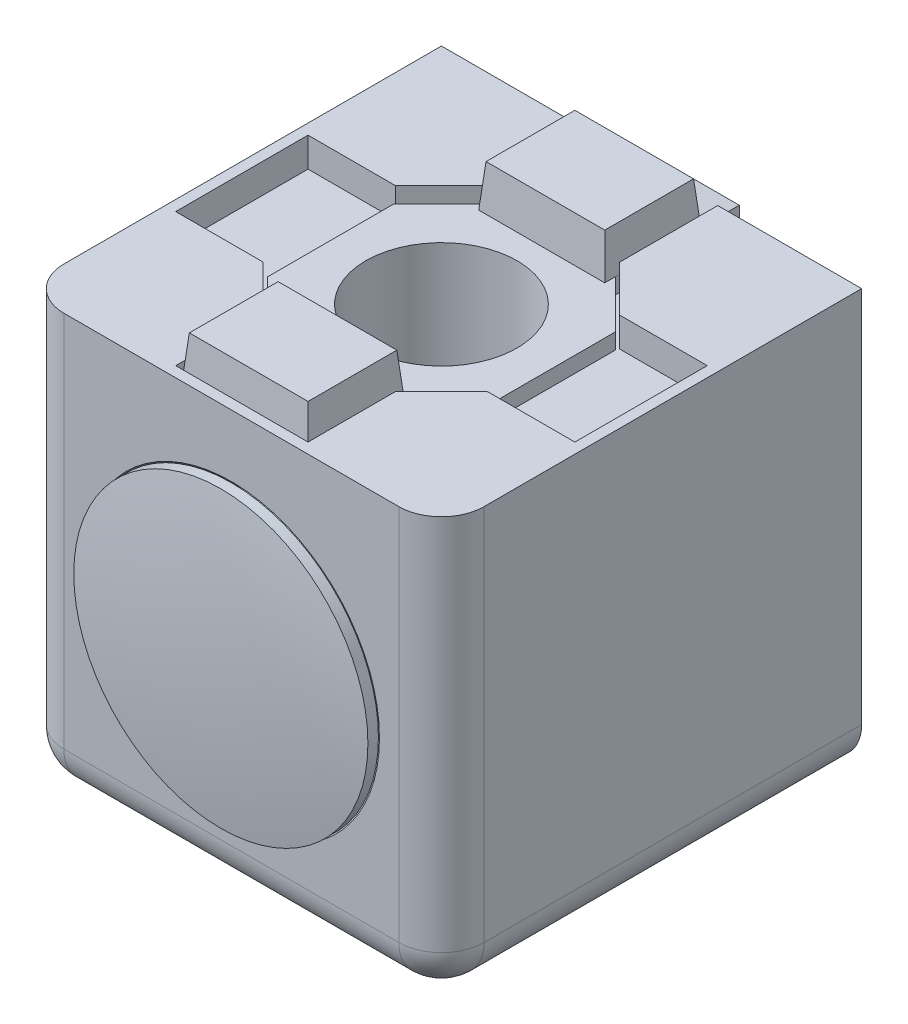
from build123d import *

# Parameters (mm, degrees)
SKETCH1_W                   = 20
SKETCH1_H                   = 20
EXTRUDE1_DEPTH              = 10
SKETCH2_R                   = 6
CUT_EXTRUDE1_DEPTH          = 25.494897428
EXTRUDE2_START              = -6
SKETCH4_R                   = 6
SKETCH4_R_2                 = 3.6
EXTRUDE2_DEPTH              = 6
CUT_EXTRUDE5_DEPTH          = 1.4
SKETCH13_R                  = 3.6
EXTRUDE3_DEPTH              = 0.75
SKETCH14_W                  = 6
SKETCH14_H                  = 4.57685066
EXTRUDE4_DEPTH              = 2
EXTRUDE4_DRAFT              = 5
EXTRUDE4_PROFILE_2_DEPTH    = 2
EXTRUDE4_PROFILE_2_DRAFT    = 5
FILLET2_R                   = 2.032
CIRPATTERN1_COUNT           = 2
CIRPATTERN1_ANGLE           = 90
CIRPATTERN1_COPY_1_SKETCH_W = 6
CIRPATTERN1_COPY_1_SKETCH_H = 4.57685066
CIRPATTERN1_COPY_1_DEPTH    = 2
CIRPATTERN1_COPY_1_DRAFT    = 5
CIRPATTERN1_COPY_2_SKETCH_W = 6
CIRPATTERN1_COPY_2_SKETCH_H = 4.57685066
CIRPATTERN1_COPY_2_DEPTH    = 2
CIRPATTERN1_COPY_2_DRAFT    = 5
CIRPATTERN1_COPY_3_SKETCH_W = 6
CIRPATTERN1_COPY_3_SKETCH_H = 4.57685066
CIRPATTERN1_COPY_3_DEPTH    = 2
CIRPATTERN1_COPY_3_DRAFT    = 5
SKETCH12_W                  = 6.3
SKETCH12_H                  = 0.5
CUT_EXTRUDE6_DEPTH          = 26.476901303


with BuildPart() as part:
    # Sketch1 → Extrude1 (new, symmetric)
    with BuildSketch(Plane.XY):
        Rectangle(SKETCH1_W, SKETCH1_H)
    extrude(amount=EXTRUDE1_DEPTH, both=True)

    # Sketch2 → Cut-Extrude1 (cut, through all)
    with BuildSketch(Plane.XY.offset(10)):
        Circle(SKETCH2_R)
    cut_extrude1 = extrude(amount=-CUT_EXTRUDE1_DEPTH, mode=Mode.SUBTRACT)

    # Cut-Extrude2 cone 1 section (through the dimple's axis) → Cut-Extrude2 (revolve, cut)
    with BuildSketch(Plane(origin=(0, 0, 10), x_dir=(0, -1, 0), z_dir=(1, 0, 0))):
        Polygon((0, 0), (7.05, 0), (0, 7.05), align=None)
    cut_extrude2 = revolve(axis=Axis((0, 0, 10), (0, 0, -1)), mode=Mode.SUBTRACT)

    # Sketch4 → Extrude2 (add)
    with BuildSketch(Plane(origin=(0, 0, -10), x_dir=(-1, 0, 0), z_dir=(0, 0, -1)).offset(EXTRUDE2_START)):
        with Locations(Location((0, 0, 0), (0, 0, 180))):
            Circle(SKETCH4_R)
        Circle(SKETCH4_R_2, mode=Mode.SUBTRACT)
    extrude2 = extrude(amount=EXTRUDE2_DEPTH)

    # Sketch10 → Cut-Extrude5 (cut)
    with BuildSketch(Plane(origin=(0, 0, -10), x_dir=(-1, 0, 0), z_dir=(0, 0, -1))):
        Polygon((-5.335281374, 3.15), (-3.15, 5.335281374), (-3.15, 9.5), (3.15, 9.5), (3.15, 5.335281374), (5.335281374, 3.15), (9.5, 3.15), (9.5, -3.15), (5.335281374, -3.15), (3.15, -5.335281374), (3.15, -9.5), (-3.15, -9.5), (-3.15, -5.335281374), (-5.335281374, -3.15), (-9.5, -3.15), (-9.5, 3.15), align=None)
    cut_extrude5 = extrude(amount=-CUT_EXTRUDE5_DEPTH, mode=Mode.SUBTRACT)

    # Sketch13 → Extrude3 (add)
    with BuildSketch(Plane(origin=(0, 0, -8.6), x_dir=(-1, 0, 0), z_dir=(0, 0, -1))):
        Polygon((5.27314934, 3), (5.27314934, -3), (3, -5.27314934), (3, -9.35), (-3, -9.35), (-3, -5.27314934), (-5.27314934, -3), (-5.27314934, 3), (-3, 5.27314934), (-3, 9.35), (3, 9.35), (3, 5.27314934), align=None)
        Circle(SKETCH13_R, mode=Mode.SUBTRACT)
    extrude3 = extrude(amount=EXTRUDE3_DEPTH)


with BuildPart() as extrude4_tool:
    # Sketch14 → Extrude4 (with draft: the straight prism first)
    with BuildSketch(Plane(origin=(0, 0, -9.35), x_dir=(-1, 0, 0), z_dir=(0, 0, -1))):
        with Locations((0, 7.06157467)):
            Rectangle(SKETCH14_W, SKETCH14_H)
    extrude(amount=EXTRUDE4_DEPTH)
    # Extrude4: the draft: its side faces are tilted about the plane it starts from
    extrude4_sides = [extrude4_tool.faces().sort_by_distance(p)[0] for p in [
        (3, 7.06157467, -10.35),
        (0, 4.77314934, -10.35),
        (-3, 7.06157467, -10.35),
        (0, 9.35, -10.35),
    ]]
    draft(extrude4_sides, Plane(origin=(0, 0, -9.35), x_dir=(-1, 0, 0), z_dir=(0, 0, -1)), EXTRUDE4_DRAFT)


with BuildPart() as part_1:
    add(part.part)

    # Extrude4: add extrude4_tool
    add(extrude4_tool.part)


with BuildPart() as extrude4_profile_2_tool:
    # Sketch14 → Extrude4 profile 2 (with draft: the straight prism first)
    with BuildSketch(Plane(origin=(0, 0, -9.35), x_dir=(-1, 0, 0), z_dir=(0, 0, -1))):
        with Locations((0, -7.06157467)):
            Rectangle(SKETCH14_W, SKETCH14_H)
    extrude(amount=EXTRUDE4_PROFILE_2_DEPTH)
    # Extrude4 profile 2: the draft: its side faces are tilted about the plane it starts from
    extrude4_profile_2_sides = [extrude4_profile_2_tool.faces().sort_by_distance(p)[0] for p in [
        (0, -9.35, -10.35),
        (-3, -7.06157467, -10.35),
        (0, -4.77314934, -10.35),
        (3, -7.06157467, -10.35),
    ]]
    draft(extrude4_profile_2_sides, Plane(origin=(0, 0, -9.35), x_dir=(-1, 0, 0), z_dir=(0, 0, -1)), EXTRUDE4_PROFILE_2_DRAFT)


with BuildPart() as part_2:
    add(part_1.part)

    # Extrude4 profile 2: add extrude4_profile_2_tool
    add(extrude4_profile_2_tool.part)

    # Fillet2
    fillet2_edges = [part_2.edges().sort_by_distance(p)[0] for p in [
        (10, 0, 10),
        (-10, 0, 10),
        (0, -10, 10),
        (10, -10, 0),
        (-10, -10, 0),
    ]]
    fillet(fillet2_edges, radius=FILLET2_R)

    # Sketch9 → Revolve1 (revolve)
    with BuildSketch(Plane(origin=(0, 0, 0), x_dir=(0, 0, -1), z_dir=(1, 0, 0)), mode=Mode.PRIVATE) as revolve1_sk:
        with BuildLine():
            Line((-10, 7), (-10, 6))
            Line((-10, 6), (-7, 6))
            Line((-7, 6), (-7, 5.5))
            Line((-7, 5.5), (-10, 5.5))
            Line((-10, 5.5), (-10, 0))
            Line((-10, 0), (-11, 0))
            ThreePointArc((-11, 0), (-10.874840967, 3.508917212), (-10.5, 7))
            Line((-10.5, 7), (-10, 7))
        make_face()
    revolve1 = revolve(revolve1_sk.sketch.rotate(Axis((0, 0, 10), (0, 0, -1)), 180), axis=Axis((0, 0, 10), (0, 0, -1)))

    # CirPattern1: Cut-Extrude1, Cut-Extrude2, Extrude2, Cut-Extrude5, Extrude3, Revolve1 ×2 about axis
    cirpattern1_axis = Axis((0, 0, 0), (1, 0, 0))
    add([cut_extrude1.rotate(cirpattern1_axis, i * CIRPATTERN1_ANGLE / (CIRPATTERN1_COUNT - 1)) for i in range(1, CIRPATTERN1_COUNT)], mode=Mode.SUBTRACT)
    add([cut_extrude2.rotate(cirpattern1_axis, i * CIRPATTERN1_ANGLE / (CIRPATTERN1_COUNT - 1)) for i in range(1, CIRPATTERN1_COUNT)], mode=Mode.SUBTRACT)
    add([extrude2.rotate(cirpattern1_axis, i * CIRPATTERN1_ANGLE / (CIRPATTERN1_COUNT - 1)) for i in range(1, CIRPATTERN1_COUNT)])
    add([cut_extrude5.rotate(cirpattern1_axis, i * CIRPATTERN1_ANGLE / (CIRPATTERN1_COUNT - 1)) for i in range(1, CIRPATTERN1_COUNT)], mode=Mode.SUBTRACT)
    add([extrude3.rotate(cirpattern1_axis, i * CIRPATTERN1_ANGLE / (CIRPATTERN1_COUNT - 1)) for i in range(1, CIRPATTERN1_COUNT)])
    add([revolve1.rotate(cirpattern1_axis, i * CIRPATTERN1_ANGLE / (CIRPATTERN1_COUNT - 1)) for i in range(1, CIRPATTERN1_COUNT)])


with BuildPart() as cirpattern1_copy_1_tool:
    # CirPattern1 copy 1 sketch → CirPattern1 copy 1 (with draft: the straight prism first)
    with BuildSketch(Plane(origin=(0, 9.35, 0), x_dir=(-1, 0, 0), z_dir=(0, 1, 0))):
        with Locations((0, 7.06157467)):
            Rectangle(CIRPATTERN1_COPY_1_SKETCH_W, CIRPATTERN1_COPY_1_SKETCH_H)
    extrude(amount=CIRPATTERN1_COPY_1_DEPTH)
    # CirPattern1 copy 1: the draft: its side faces are tilted about the plane it starts from
    cirpattern1_copy_1_sides = [cirpattern1_copy_1_tool.faces().sort_by_distance(p)[0] for p in [
        (3, 10.35, 7.06157467),
        (0, 10.35, 4.77314934),
        (-3, 10.35, 7.06157467),
        (0, 10.35, 9.35),
    ]]
    draft(cirpattern1_copy_1_sides, Plane(origin=(0, 9.35, 0), x_dir=(-1, 0, 0), z_dir=(0, 1, 0)), CIRPATTERN1_COPY_1_DRAFT)


with BuildPart() as part_3:
    add(part_2.part)

    # CirPattern1 copy 1: add cirpattern1_copy_1_tool
    add(cirpattern1_copy_1_tool.part)


with BuildPart() as cirpattern1_copy_2_tool:
    # CirPattern1 copy 2 sketch → CirPattern1 copy 2 (with draft: the straight prism first)
    with BuildSketch(Plane(origin=(0, 9.35, 0), x_dir=(-1, 0, 0), z_dir=(0, 1, 0))):
        with Locations((0, -7.06157467)):
            Rectangle(CIRPATTERN1_COPY_2_SKETCH_W, CIRPATTERN1_COPY_2_SKETCH_H)
    extrude(amount=CIRPATTERN1_COPY_2_DEPTH)
    # CirPattern1 copy 2: the draft: its side faces are tilted about the plane it starts from
    cirpattern1_copy_2_sides = [cirpattern1_copy_2_tool.faces().sort_by_distance(p)[0] for p in [
        (0, 10.35, -9.35),
        (-3, 10.35, -7.06157467),
        (0, 10.35, -4.77314934),
        (3, 10.35, -7.06157467),
    ]]
    draft(cirpattern1_copy_2_sides, Plane(origin=(0, 9.35, 0), x_dir=(-1, 0, 0), z_dir=(0, 1, 0)), CIRPATTERN1_COPY_2_DRAFT)


with BuildPart() as part_4:
    add(part_3.part)

    # CirPattern1 copy 2: add cirpattern1_copy_2_tool
    add(cirpattern1_copy_2_tool.part)


with BuildPart() as cirpattern1_copy_3_tool:
    # CirPattern1 copy 3 sketch → CirPattern1 copy 3 (with draft: the straight prism first)
    with BuildSketch(Plane(origin=(0, 9.35, 0), x_dir=(-1, 0, 0), z_dir=(0, 1, 0))):
        with Locations((0, -7.06157467)):
            Rectangle(CIRPATTERN1_COPY_3_SKETCH_W, CIRPATTERN1_COPY_3_SKETCH_H)
    extrude(amount=CIRPATTERN1_COPY_3_DEPTH)
    # CirPattern1 copy 3: the draft: its side faces are tilted about the plane it starts from
    cirpattern1_copy_3_sides = [cirpattern1_copy_3_tool.faces().sort_by_distance(p)[0] for p in [
        (0, 10.35, -9.35),
        (-3, 10.35, -7.06157467),
        (0, 10.35, -4.77314934),
        (3, 10.35, -7.06157467),
    ]]
    draft(cirpattern1_copy_3_sides, Plane(origin=(0, 9.35, 0), x_dir=(-1, 0, 0), z_dir=(0, 1, 0)), CIRPATTERN1_COPY_3_DRAFT)


with BuildPart() as part_5:
    add(part_4.part)

    # CirPattern1 copy 3: add cirpattern1_copy_3_tool
    add(cirpattern1_copy_3_tool.part)

    # Sketch12 → Cut-Extrude6 (cut, through all)
    with BuildSketch(Plane.XZ.offset(-9.5)):
        with Locations((0, -9.75)):
            Rectangle(SKETCH12_W, SKETCH12_H)
    extrude(amount=-CUT_EXTRUDE6_DEPTH, mode=Mode.SUBTRACT)


solid = part_5.part
